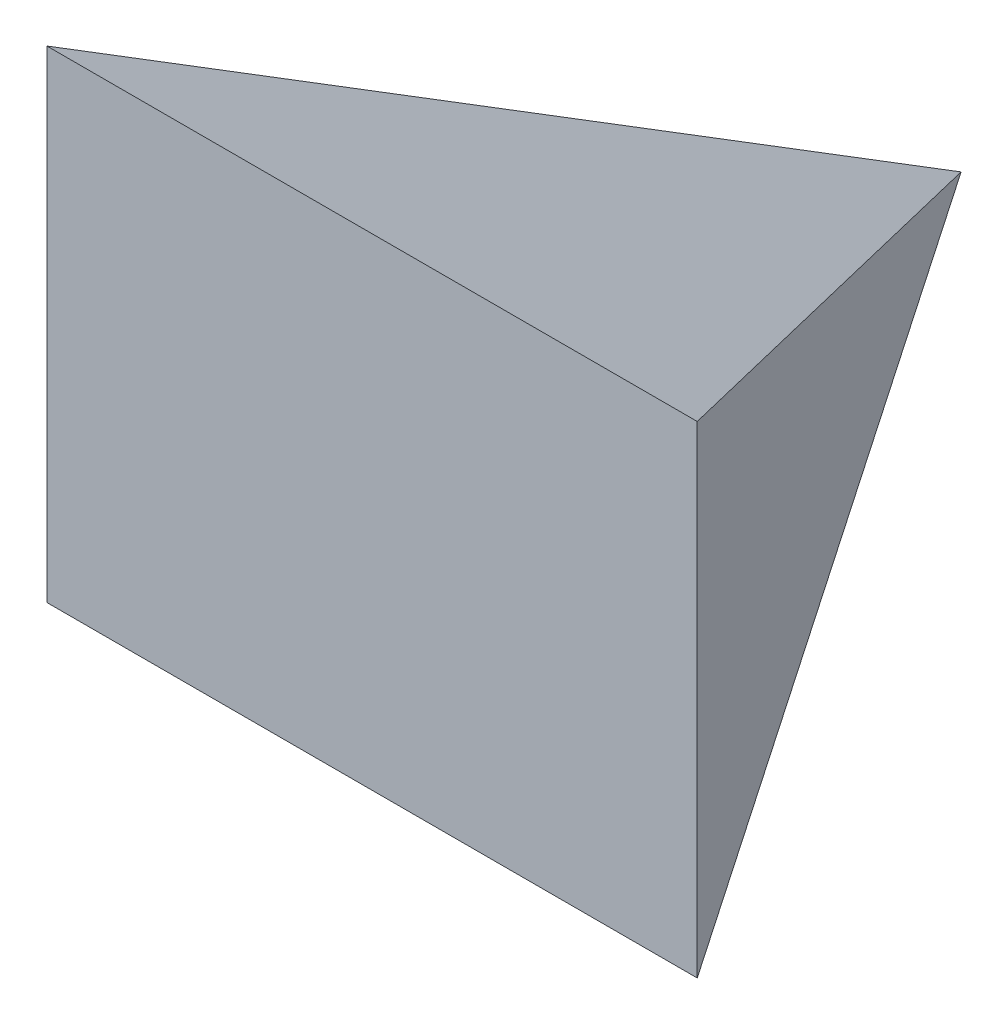
from build123d import *

# Parameters (mm, degrees)
BOSS_EXTRUDE1_DEPTH     = 250
CUT_EXTRUDE1_DEPTH      = 425.177211644
CUT_EXTRUDE1_DEPTH_BACK = 425.177211644
SKETCH2_OUTSIDE_W       = 404.412
SKETCH2_OUTSIDE_H       = 354.412


with BuildPart() as part:
    # Sketch1 → Boss-Extrude1 (new body)
    with BuildSketch(Plane(origin=(0, 0, 0), x_dir=(1, 0, 0), z_dir=(0, 1, 0))):
        Polygon((0, 0), (-165.60889734, -300), (165.60889734, -300), align=None)
    extrude(amount=BOSS_EXTRUDE1_DEPTH)

    # Sketch2 outside → Cut-Extrude1 (cut, two sides: drawn at the far end of the back side and taken through both)
    with BuildSketch(Plane(origin=(0, 0, 0), x_dir=(0, 0, -1), z_dir=(1, 0, 0)).offset(-CUT_EXTRUDE1_DEPTH_BACK)):
        with Locations((-150, 125)):
            Rectangle(SKETCH2_OUTSIDE_W, SKETCH2_OUTSIDE_H)
        Polygon((0, 125), (-300, 247.733240428), (-300, 2.266759572), align=None, mode=Mode.SUBTRACT)
    extrude(amount=CUT_EXTRUDE1_DEPTH + CUT_EXTRUDE1_DEPTH_BACK, mode=Mode.SUBTRACT)


solid = part.part
